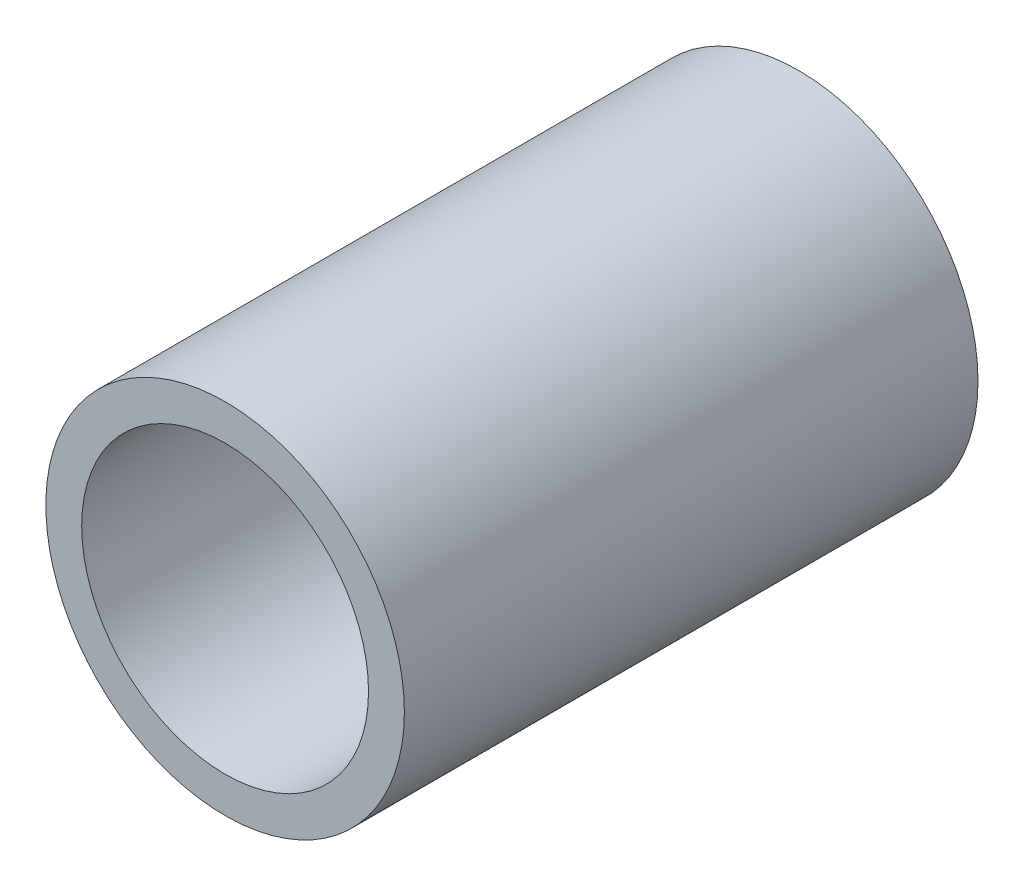
from build123d import *

# Parameters (mm, degrees)
SKETCH1_R           = 0.635
SKETCH1_R_2         = 0.508
BOSS_EXTRUDE1_DEPTH = 2.032


with BuildPart() as part:
    # Sketch1 → Boss-Extrude1 (new body)
    with BuildSketch(Plane.XY):
        with Locations((-3.473967256, 0)):
            Circle(SKETCH1_R)
        with Locations((-3.473967256, 0)):
            Circle(SKETCH1_R_2, mode=Mode.SUBTRACT)
    extrude(amount=-BOSS_EXTRUDE1_DEPTH)


solid = part.part
